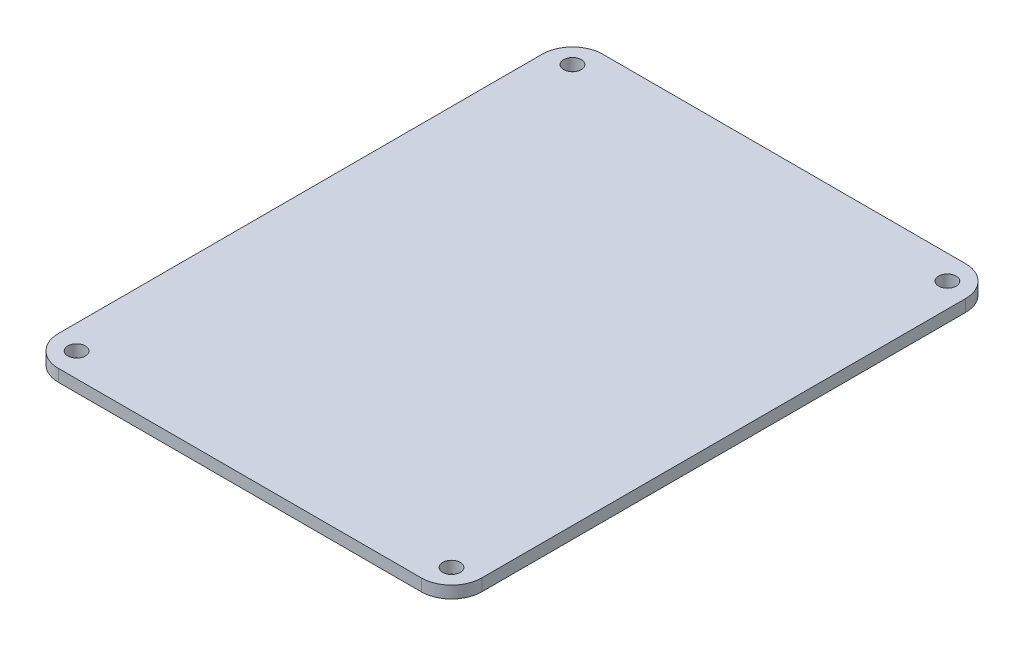
from build123d import *

# Parameters (mm, degrees)
SKETCH1_W           = 88.9
SKETCH1_H           = 114.3
BOSS_EXTRUDE1_DEPTH = 2.54
SKETCH2_R           = 1.8415
CUT_EXTRUDE1_DEPTH  = 73.445680341
FILLET1_R           = 6.35


with BuildPart() as part:
    # Sketch1 → Boss-Extrude1 (new body)
    with BuildSketch(Plane(origin=(0, 0, 0), x_dir=(1, 0, 0), z_dir=(0, 1, 0))):
        Rectangle(SKETCH1_W, SKETCH1_H)
    extrude(amount=BOSS_EXTRUDE1_DEPTH)

    # Sketch2 → Cut-Extrude1 (cut, through all)
    with BuildSketch(Plane(origin=(0, 2.54, 0), x_dir=(1, 0, 0), z_dir=(0, 1, 0))):
        with Locations(Location((-39.37, 52.07, 0), (0, 0, 270))):
            Circle(SKETCH2_R)
        with Locations(Location((39.37, 52.07, 0), (0, 0, 270))):
            Circle(SKETCH2_R)
        with Locations(Location((-39.37, -52.07, 0), (0, 0, 270))):
            Circle(SKETCH2_R)
        with Locations(Location((39.37, -52.07, 0), (0, 0, 270))):
            Circle(SKETCH2_R)
    extrude(amount=-CUT_EXTRUDE1_DEPTH, mode=Mode.SUBTRACT)

    # Fillet1
    fillet1_edges = [part.edges().sort_by_distance(p)[0] for p in [
        (44.45, 1.27, 57.15),
        (-44.45, 1.27, 57.15),
        (-44.45, 1.27, -57.15),
        (44.45, 1.27, -57.15),
    ]]
    fillet(fillet1_edges, radius=FILLET1_R)


solid = part.part
